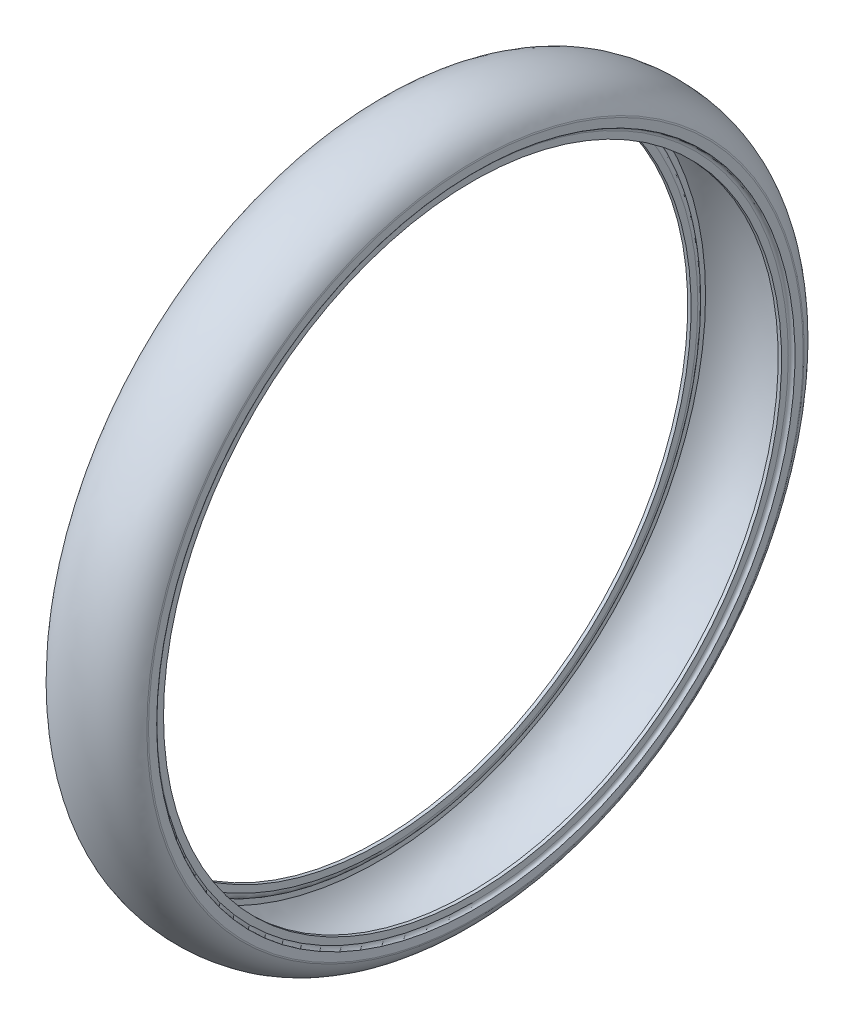
from build123d import *


with BuildPart() as part:
    # Sketch3 → Revolve1 (revolve)
    with BuildSketch(Plane.XY, mode=Mode.PRIVATE) as revolve1_sk:
        with BuildLine():
            Line((29.922151189, 190.453309169), (29.959237614, 195.377533015))
            ThreePointArc((29.959237614, 195.377533015), (29.919342353, 195.79035386), (29.795158813, 196.186069833))
            add(Edge.make_bspline(
                [(-29.556990141, 196.16324436), (-21.53032751, 207.553282451), (-1.319818558, 214.35673335), (24.651498238, 208.086975281), (29.795158813, 196.186069833)],
                knots=[0.008653758, 0.008653758, 0.008653758, 0.008653758, 0.499413505, 0.989683095, 0.989683095, 0.989683095, 0.989683095], degree=3))
            ThreePointArc((-29.556990141, 196.16324436), (-29.82867655, 195.615444167), (-29.922151189, 195.011158598))
            Line((-29.922151189, 195.011158598), (-29.922151189, 190.453309169))
            Line((-29.922151189, 190.453309169), (-29.997329698, 190.453309169))
            ThreePointArc((-29.997329698, 190.453309169), (-28.583116135, 189.867522731), (-27.997329698, 188.453309169))
            Line((-27.997329698, 188.453309169), (-27.997329698, 184.453309169))
            Line((-27.997329698, 184.453309169), (-25.997329698, 184.453309169))
            Line((-25.997329698, 184.453309169), (-25.997329698, 188.453309169))
            ThreePointArc((-25.997329698, 188.453309169), (-26.511593475, 190.415359877), (-27.922151189, 191.872904782))
            Line((-27.922151189, 191.872904782), (-27.922151189, 195.011158598))
            add(Edge.make_bspline(
                [(-27.922151189, 195.011158598), (-27.685415313, 195.347092818), (-27.197890608, 196.018474921), (-26.221222638, 197.283543916), (-24.972739592, 198.757340926), (-23.439178174, 200.3513349), (-21.34508157, 202.259647181), (-18.636260658, 204.258701964), (-15.232594238, 206.109100247), (-11.662628086, 207.472279037), (-6.671801563, 208.710119895), (0.042946591, 209.286544548), (8.671030055, 208.789989675), (15.443623036, 207.004500137), (20.194601728, 204.565969407), (23.332273245, 202.192241493), (25.53943247, 199.700965982), (27.018804746, 197.376242979), (27.67242145, 196.056334233), (27.959294334, 195.392595438)],
                knots=[0.008653758, 0.008653758, 0.008653758, 0.008653758, 0.023982341, 0.039310925, 0.069968092, 0.100625258, 0.131282425, 0.192596759, 0.253911092, 0.315225426, 0.37653976, 0.499168427, 0.621797094, 0.744425761, 0.805740095, 0.867054428, 0.928368762, 0.959025929, 0.989683095, 0.989683095, 0.989683095, 0.989683095], degree=3))
            Line((27.959294334, 195.392595438), (27.932834703, 191.879365271))
            ThreePointArc((27.932834703, 191.879365271), (26.514659746, 190.420797418), (25.997329698, 188.453309169))
            Line((25.997329698, 188.453309169), (25.997329698, 184.453309169))
            Line((25.997329698, 184.453309169), (27.997329698, 184.453309169))
            Line((27.997329698, 184.453309169), (27.997329698, 188.453309169))
            ThreePointArc((27.997329698, 188.453309169), (28.583116135, 189.867522731), (29.997329698, 190.453309169))
            Line((29.997329698, 190.453309169), (29.922151189, 190.453309169))
        make_face()
    revolve(revolve1_sk.sketch.rotate(Axis((-69.700321806, 0, 0), (1, 0, 0)), 90), axis=Axis((-69.700321806, 0, 0), (1, 0, 0)))


solid = part.part
